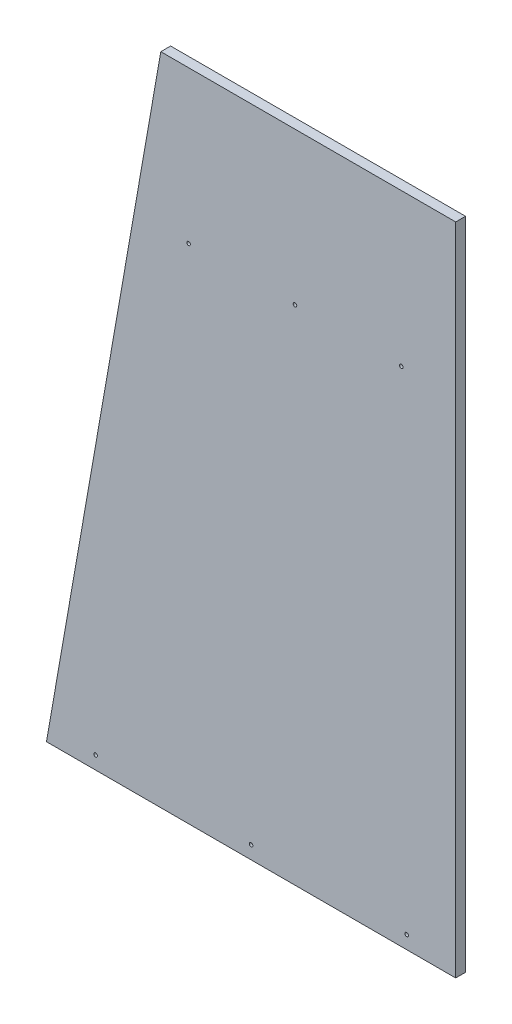
from build123d import *

# Parameters (mm, degrees)
SKETCH_1_R      = 1.1
EXTRUDE_1_DEPTH = 6


with BuildPart() as part:
    # Эскиз1 → Бобышка-Вытянуть1 (new body)
    with BuildSketch(Plane.XY):
        Polygon((0, 0), (69.841269841, 400), (250, 400), (250, 0), align=None)
        with Locations((86.803174603, 307)):
            Circle(SKETCH_1_R, mode=Mode.SUBTRACT)
        with Locations((151.803174603, 307)):
            Circle(SKETCH_1_R, mode=Mode.SUBTRACT)
        with Locations((30, 8)):
            Circle(SKETCH_1_R, mode=Mode.SUBTRACT)
        with Locations((220, 8)):
            Circle(SKETCH_1_R, mode=Mode.SUBTRACT)
        with Locations((125, 8)):
            Circle(SKETCH_1_R, mode=Mode.SUBTRACT)
        with Locations((216.803174603, 307)):
            Circle(SKETCH_1_R, mode=Mode.SUBTRACT)
    extrude(amount=EXTRUDE_1_DEPTH)


solid = part.part
